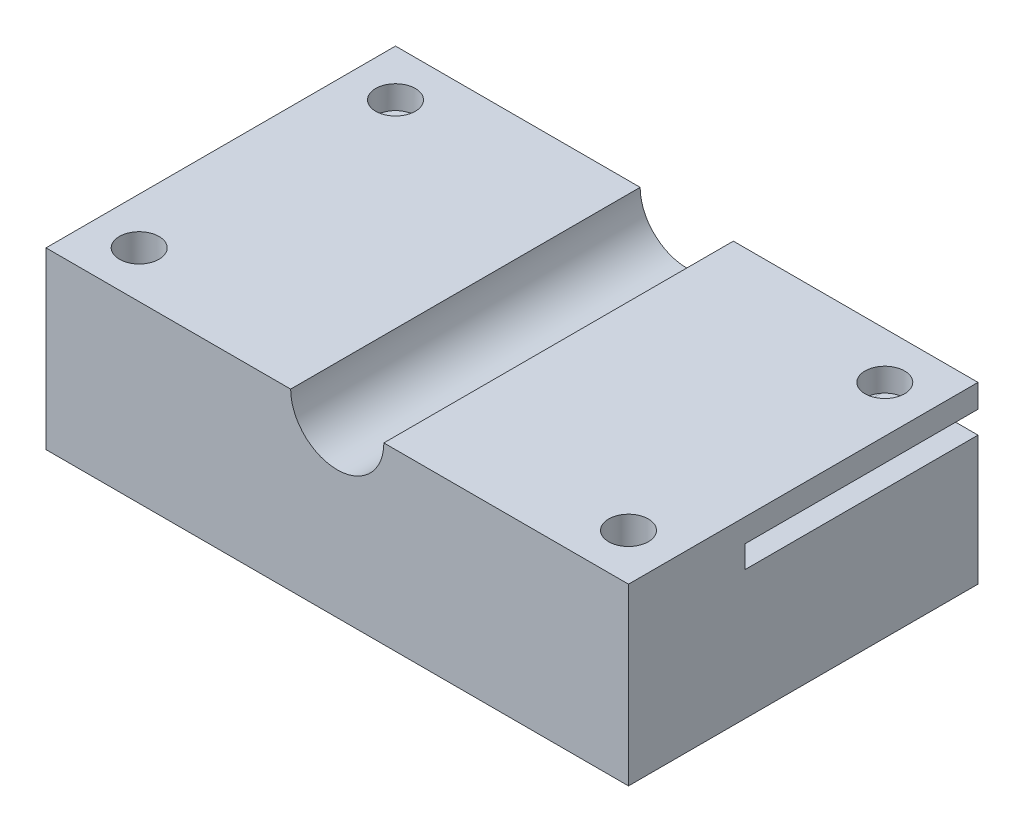
from build123d import *

# Parameters (mm, degrees)
SCHIZZO1_W                   = 50
SCHIZZO1_H                   = 15
ESTRUSIONE_ESTRUSIONE1_DEPTH = 30
SCHIZZO2_R                   = 4.08343654
TAGLIO_ESTRUSIONE1_DEPTH     = 20
SCHIZZO6_R                   = 1.7
TAGLIO_ESTRUSIONE3_DEPTH     = 30
SCHIZZO9_R                   = 4
TAGLIO_ESTRUSIONE5_DEPTH     = 64.492497112


with BuildPart() as part:
    # Schizzo1 → Estrusione-Estrusione1 (new body)
    with BuildSketch(Plane.XY):
        with Locations((25, 17.625628141)):
            Rectangle(SCHIZZO1_W, SCHIZZO1_H)
    extrude(amount=ESTRUSIONE_ESTRUSIONE1_DEPTH)

    # Schizzo2 → Taglio-Estrusione1 (cut)
    # profile 1 of 2: a face of its own
    with BuildSketch(Plane.XY):
        with BuildLine():
            ThreePointArc((16.544218644, 23.125628141), (21.393626777, 14.807370827), (11.765784724, 14.685627772))
            Line((11.765784724, 14.685627772), (11.214334392, 16.016946643))
            Line((11.214334392, 16.016946643), (10.994077631, 17.936406255))
            Line((10.994077631, 17.936406255), (10.89812606, 18.418787382))
            Line((10.89812606, 18.418787382), (10.740031995, 18.884517478))
            Line((10.740031995, 18.884517478), (10.522500471, 19.325627772))
            Line((10.522500471, 19.325627772), (10.249253512, 19.734570745))
            Line((10.249253512, 19.734570745), (9.92496645, 20.10434927))
            Line((9.92496645, 20.10434927), (9.555187926, 20.428636332))
            Line((9.555187926, 20.428636332), (9.146244953, 20.701883291))
            Line((9.146244953, 20.701883291), (8.705134658, 20.919414815))
            Line((8.705134658, 20.919414815), (8.239404562, 21.077508879))
            Line((8.239404562, 21.077508879), (7.757023435, 21.173460451))
            Line((7.757023435, 21.173460451), (7.266244953, 21.205627772))
            Line((7.266244953, 21.205627772), (-0.789507737, 21.205627772))
            Line((-0.789507737, 21.205627772), (-0.789507737, 23.125628141))
            Line((-0.789507737, 23.125628141), (16.544218644, 23.125628141))
        make_face()
        with Locations((16.544218644, 17.552936622)):
            Circle(SCHIZZO2_R, mode=Mode.SUBTRACT)
    # profile 2 of 2: a face of its own
    with BuildSketch(Plane.XY):
        with BuildLine():
            Line((33.455781356, 23.125628141), (50.789507737, 23.125628141))
            Line((50.789507737, 23.125628141), (50.789507737, 21.205627772))
            Line((50.789507737, 21.205627772), (42.733755047, 21.205627772))
            Line((42.733755047, 21.205627772), (42.242976565, 21.173460451))
            Line((42.242976565, 21.173460451), (41.760595438, 21.077508879))
            Line((41.760595438, 21.077508879), (41.294865342, 20.919414815))
            Line((41.294865342, 20.919414815), (40.853755047, 20.701883291))
            Line((40.853755047, 20.701883291), (40.444812074, 20.428636332))
            Line((40.444812074, 20.428636332), (40.07503355, 20.10434927))
            Line((40.07503355, 20.10434927), (39.750746488, 19.734570745))
            Line((39.750746488, 19.734570745), (39.477499529, 19.325627772))
            Line((39.477499529, 19.325627772), (39.259968005, 18.884517478))
            Line((39.259968005, 18.884517478), (39.10187394, 18.418787382))
            Line((39.10187394, 18.418787382), (39.005922369, 17.936406255))
            Line((39.005922369, 17.936406255), (38.785665608, 16.016946643))
            Line((38.785665608, 16.016946643), (38.234215276, 14.685627772))
            ThreePointArc((38.234215276, 14.685627772), (28.606373223, 14.807370827), (33.455781356, 23.125628141))
        make_face()
        with Locations((33.455781356, 17.552936622)):
            Circle(SCHIZZO2_R, mode=Mode.SUBTRACT)
    extrude(amount=TAGLIO_ESTRUSIONE1_DEPTH, mode=Mode.SUBTRACT)

    # Schizzo6 → Taglio-Estrusione3 (cut)
    with BuildSketch(Plane(origin=(0, 25.125628141, 0), x_dir=(1, 0, 0), z_dir=(0, 1, 0))):
        with Locations(Location((4, -4, 0), (0, 0, 270))):
            Circle(SCHIZZO6_R)
        with Locations(Location((46, -4, 0), (0, 0, 270))):
            Circle(SCHIZZO6_R)
        with Locations(Location((46, -26, 0), (0, 0, 270))):
            Circle(SCHIZZO6_R)
        with Locations(Location((4, -26, 0), (0, 0, 270))):
            Circle(SCHIZZO6_R)
    extrude(amount=-TAGLIO_ESTRUSIONE3_DEPTH, mode=Mode.SUBTRACT)

    # Schizzo9 → Taglio-Estrusione5 (cut, through all)
    with BuildSketch(Plane(origin=(0, 0, 0), x_dir=(-1, 0, 0), z_dir=(0, 0, -1))):
        with Locations((-25, 25.125628141)):
            Circle(SCHIZZO9_R)
    extrude(amount=-TAGLIO_ESTRUSIONE5_DEPTH, mode=Mode.SUBTRACT)


solid = part.part
